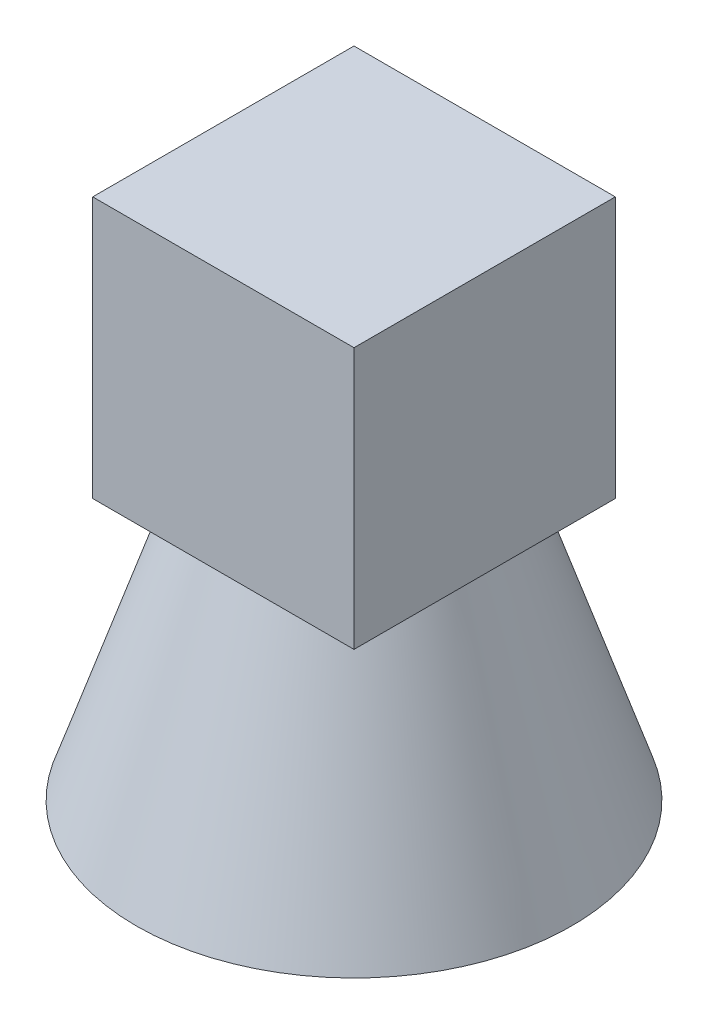
from build123d import *

# Parameters (mm, degrees)
SKETCH_2_W      = 30
SKETCH_2_H      = 30
EXTRUDE_1_DEPTH = 30


with BuildPart() as part:
    # 草图2 → 凸台-拉伸1 (new body)
    with BuildSketch(Plane(origin=(0, 0, 0), x_dir=(1, 0, 0), z_dir=(0, 1, 0))):
        Rectangle(SKETCH_2_W, SKETCH_2_H)
    extrude(amount=EXTRUDE_1_DEPTH)

    # 草图3 → 旋转1 (revolve)
    with BuildSketch(Plane.XY, mode=Mode.PRIVATE) as revolve_1_sk:
        Polygon((0, 0), (15, 0), (25, -30), (0, -30), align=None)
    revolve(revolve_1_sk.sketch.rotate(Axis((0, -30, 0), (0, 1, 0)), 90), axis=Axis((0, -30, 0), (0, 1, 0)))


solid = part.part
